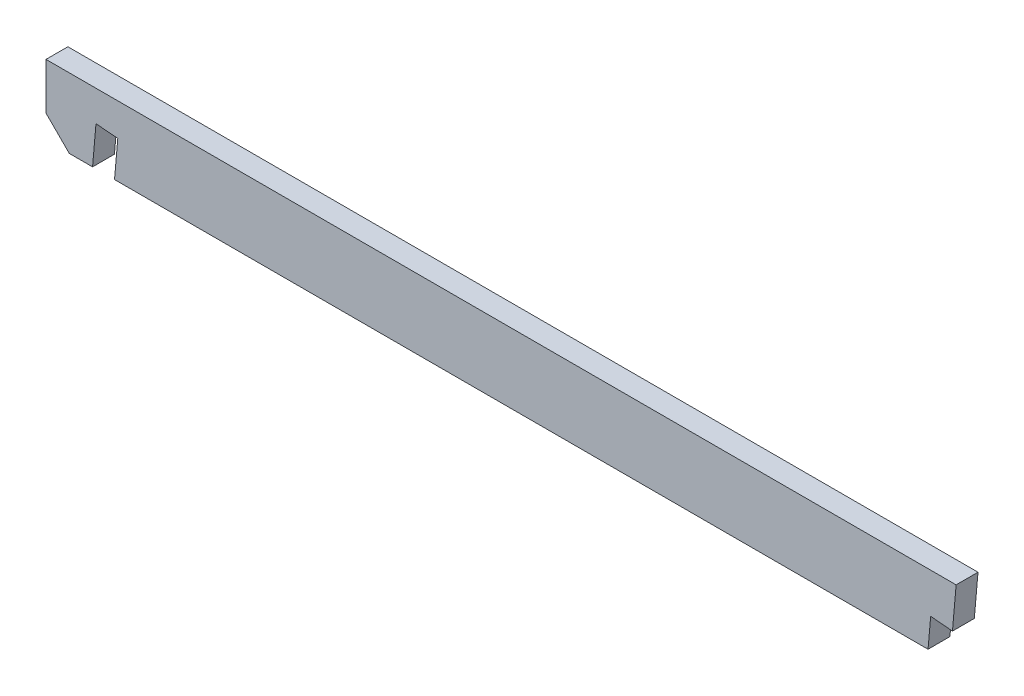
from build123d import *

# Parameters (mm, degrees)
SKETCH1_W           = 47
SKETCH1_H           = 150
BOSS_EXTRUDE1_DEPTH = 1955
CUT_EXTRUDE1_DEPTH  = 1958.002554929
CHAMFER1_SIZE       = 50
CUT_EXTRUDE2_DEPTH  = 1958.002554929
CUT_EXTRUDE3_DEPTH  = 1958.002554929


with BuildPart() as part:
    # Sketch1 → Boss-Extrude1 (new body)
    with BuildSketch(Plane(origin=(0, 0, 0), x_dir=(0, 0, -1), z_dir=(1, 0, 0))):
        Rectangle(SKETCH1_W, SKETCH1_H)
    extrude(amount=BOSS_EXTRUDE1_DEPTH)

    # Sketch2 → Cut-Extrude1 (cut, through all)
    with BuildSketch(Plane.XY.offset(23.5)):
        Polygon((100, -75), (107.357474636, 9.096319909), (154.178625447, 5), (147.179532365, -75), align=None)
    extrude(amount=-CUT_EXTRUDE1_DEPTH, mode=Mode.SUBTRACT)

    # Chamfer1
    chamfer1_edges = [part.edges().sort_by_distance(p)[0] for p in [
        (0, -75, 0),
    ]]
    chamfer(chamfer1_edges, length=CHAMFER1_SIZE)

    # Sketch3 → Cut-Extrude2 (cut, through all)
    with BuildSketch(Plane(origin=(0, 0, -23.5), x_dir=(-1, 0, 0), z_dir=(0, 0, -1))):
        Polygon((-1955, 75), (-1941.876700471, -75), (-1955, -75), align=None)
    extrude(amount=-CUT_EXTRUDE2_DEPTH, mode=Mode.SUBTRACT)

    # Sketch4 → Cut-Extrude3 (cut, through all)
    with BuildSketch(Plane.XY.offset(23.5)):
        Polygon((1947.126020283, -15), (1900.304869472, -10.903680091), (1894.697168107, -75), (1941.876700471, -75), align=None)
    extrude(amount=-CUT_EXTRUDE3_DEPTH, mode=Mode.SUBTRACT)


solid = part.part
